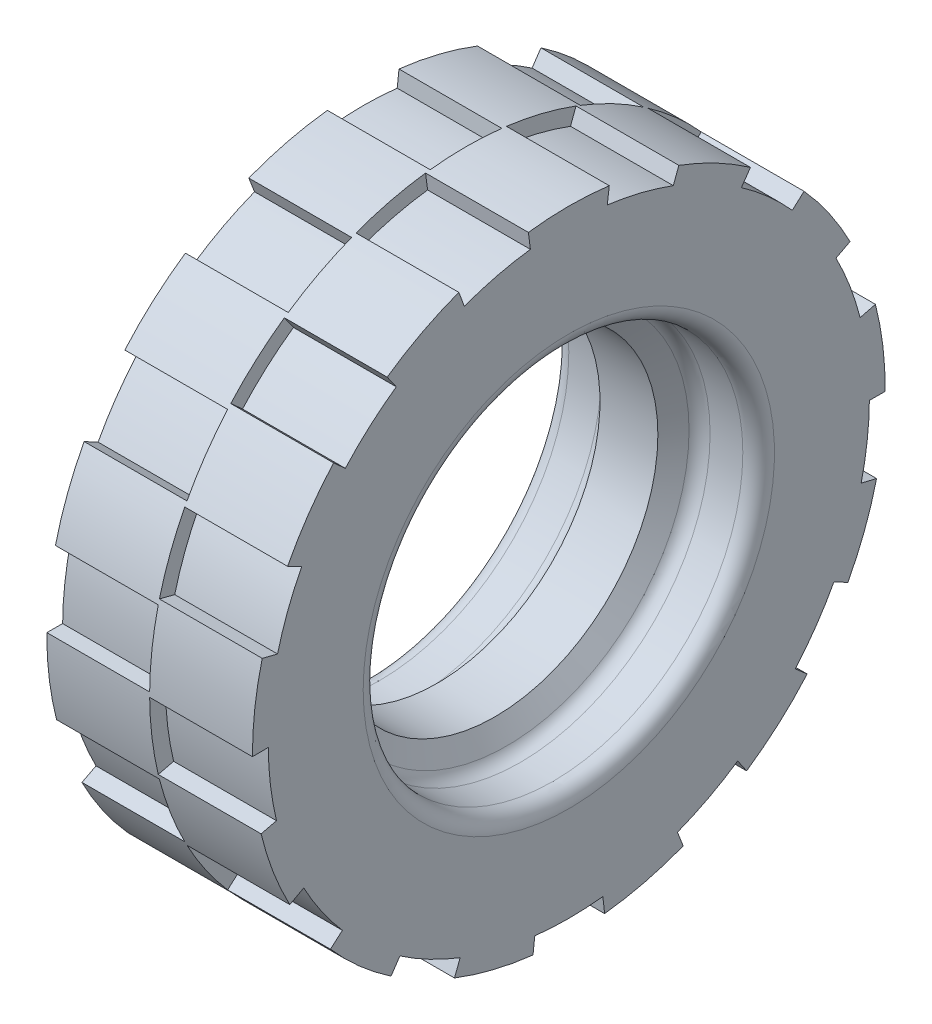
from build123d import *

# Parameters (mm, degrees)
CUT_EXTRUDE1_START = -3.25
CUT_EXTRUDE1_DEPTH = 3.25
CIRPATTERN1_COUNT  = 13
CUT_EXTRUDE2_DEPTH = 3.25
CIRPATTERN2_COUNT  = 13
FILLET1_R          = 0.5


with BuildPart() as part:
    # Sketch1 → Revolve1 (revolve)
    with BuildSketch(Plane.XY, mode=Mode.PRIVATE) as revolve1_sk:
        Polygon((-3.25, 10), (3.25, 10), (3.25, 6), (1.435, 6), (0.915, 5.15), (-0.915, 5.15), (-1.435, 6), (-3.25, 6), align=None)
    revolve(revolve1_sk.sketch.rotate(Axis((0, 0, 0), (1, 0, 0)), 90), axis=Axis((0, 0, 0), (1, 0, 0)))

    # Sketch2 → Cut-Extrude1 (cut)
    with BuildSketch(Plane.ZY.offset(3.25).offset(CUT_EXTRUDE1_START)):
        with BuildLine():
            Line((-1.075430531, 9.438932629), (-1.132032138, 9.935718557))
            ThreePointArc((-1.132032138, 9.935718557), (0, 10), (1.132032138, 9.935718557))
            Line((1.132032138, 9.935718557), (1.075430531, 9.438932629))
            ThreePointArc((1.075430531, 9.438932629), (0, 9.5), (-1.075430531, 9.438932629))
        make_face()
    cut_extrude1 = extrude(amount=CUT_EXTRUDE1_DEPTH, mode=Mode.SUBTRACT)

    # CirPattern1: Cut-Extrude1 ×13 about axis
    cirpattern1_axis = Axis((0, 0, 0), (1, 0, 0))
    for i in range(1, CIRPATTERN1_COUNT):
        add(cut_extrude1.rotate(cirpattern1_axis, i * 360 / CIRPATTERN1_COUNT), mode=Mode.SUBTRACT)

    # Sketch3 → Cut-Extrude2 (cut)
    with BuildSketch(Plane(origin=(3.25, 0, 0), x_dir=(0, 0, -1), z_dir=(1, 0, 0))):
        with BuildLine():
            Line((-3.302885527, 8.907353546), (-3.476721607, 9.376161627))
            ThreePointArc((-3.476721607, 9.376161627), (-2.39296111, 9.709466367), (-1.278436014, 9.917943404))
            Line((-1.278436014, 9.917943404), (-1.214514213, 9.422046233))
            ThreePointArc((-1.214514213, 9.422046233), (-2.273313055, 9.223993048), (-3.302885527, 8.907353546))
        make_face()
    cut_extrude2 = extrude(amount=-CUT_EXTRUDE2_DEPTH, mode=Mode.SUBTRACT)

    # CirPattern2: Cut-Extrude2 ×13 about axis
    cirpattern2_axis = Axis((0, 0, 0), (1, 0, 0))
    for i in range(1, CIRPATTERN2_COUNT):
        add(cut_extrude2.rotate(cirpattern2_axis, i * 360 / CIRPATTERN2_COUNT), mode=Mode.SUBTRACT)

    # Fillet1
    fillet1_edges = [part.edges().sort_by_distance(p)[0] for p in [
        (1.435, 0, -6),
        (3.25, 0, -6),
        (-3.25, 0, -6),
        (-1.435, 0, -6),
    ]]
    fillet(fillet1_edges, radius=FILLET1_R)


solid = part.part
